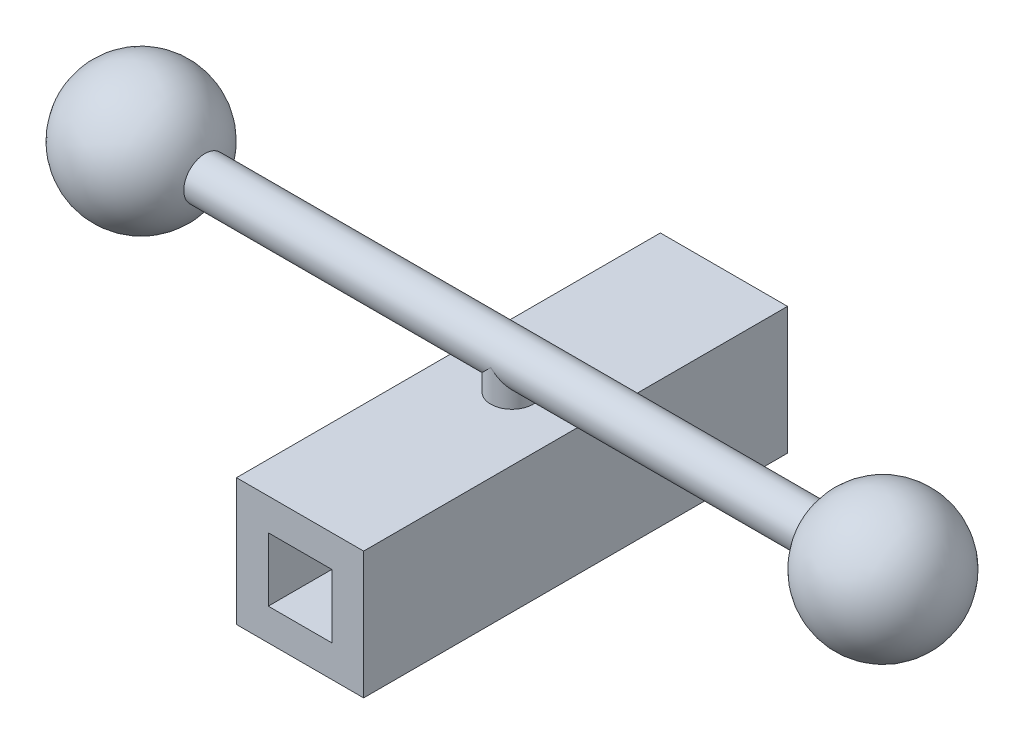
from build123d import *

# Parameters (mm, degrees)
ESQUISSE1_W        = 12
ESQUISSE1_H        = 12
ESQUISSE1_W_2      = 6
ESQUISSE1_H_2      = 6
BOSS_EXTRU_1_DEPTH = 20
ESQUISSE2_R        = 2


with BuildPart() as part:
    # Esquisse1 → Boss.-Extru.1 (new, symmetric)
    with BuildSketch(Plane.XY):
        Rectangle(ESQUISSE1_W, ESQUISSE1_H)
        Rectangle(ESQUISSE1_W_2, ESQUISSE1_H_2, mode=Mode.SUBTRACT)
    extrude(amount=BOSS_EXTRU_1_DEPTH, both=True)

    # Balayage1: sweep along a curve in space
    with BuildLine() as balayage1_path:
        Line((0, 6, 0), (0, 9, 0))
        Line((0, 9, 0), (-35, 9, 0))
    # Esquisse2 → Balayage1 (sweep)
    with BuildSketch(Plane(origin=(0, 6, 0), x_dir=(1, 0, 0), z_dir=(0, 1, 0))):
        Circle(ESQUISSE2_R)
    balayage1 = sweep(path=balayage1_path.line, transition=Transition.RIGHT)

    # Esquisse3 → Révolution1 (revolve)
    with BuildSketch(Plane.XY):
        with BuildLine():
            Line((-35, 15.35), (-35, 2.65))
            ThreePointArc((-35, 2.65), (-41.35, 9), (-35, 15.35))
        make_face()
    r_volution1 = revolve(axis=Axis((-35, 15.35, 0), (0, -1, 0)))

    # Symétrie1: Balayage1, Révolution1 across plane
    add(balayage1.mirror(Plane(origin=(0, 0, 0), x_dir=(0, 0, 1), z_dir=(1, 0, 0))))
    add(r_volution1.mirror(Plane(origin=(0, 0, 0), x_dir=(0, 0, 1), z_dir=(1, 0, 0))))


solid = part.part
